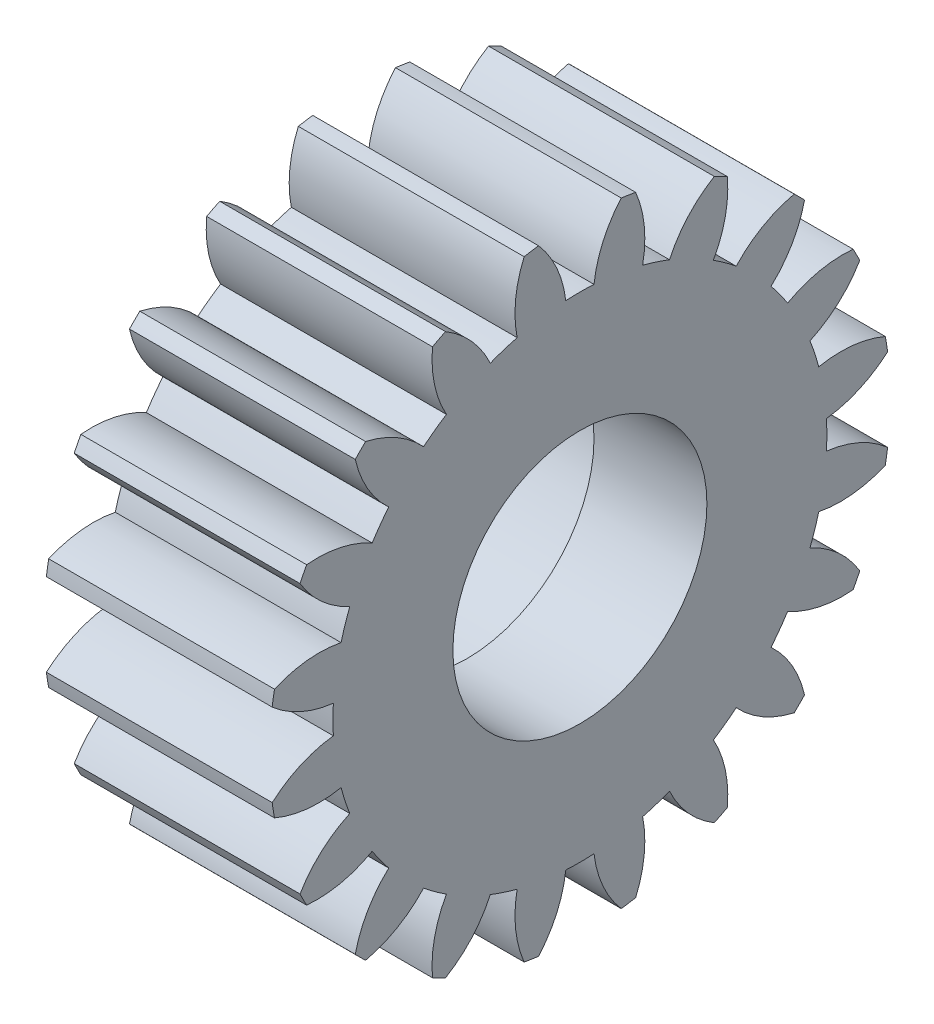
from build123d import *

# Parameters (mm, degrees)
BASPROSKE_W        = 10
BASPROSKE_H        = 11
TOOTHCUT_DEPTH     = 19.493242009
TEETHCUTS_COUNT    = 20
TEETHCUTS_ANGLE    = 342
BORSKE_R           = 2.5
BORE_DEPTH         = 50.0000508
SKETCH1_R          = 6.1
CUT_EXTRUDE1_DEPTH = 4
SKETCH2_R          = 4.5
CUT_EXTRUDE2_DEPTH = 19.376827944
SKETCH3_R          = 14.898414192
CUT_EXTRUDE3_DEPTH = 2


with BuildPart() as part:
    # BasProSke → Base-Revolve (revolve)
    with BuildSketch(Plane(origin=(0, 0, 0), x_dir=(1, 0, 0), z_dir=(0, 1, 0)), mode=Mode.PRIVATE) as base_revolve_sk:
        with Locations((5, 5.5)):
            Rectangle(BASPROSKE_W, BASPROSKE_H)
    revolve(base_revolve_sk.sketch.rotate(Axis((-10, 0, 0), (1, 0, 0)), 180), axis=Axis((-10, 0, 0), (1, 0, 0)))

    # TooCutSke → ToothCut (cut, through all)
    with BuildSketch(Plane(origin=(0, 0, 0), x_dir=(0, 0, -1), z_dir=(1, 0, 0))):
        with BuildLine():
            ThreePointArc((0.499924007, 8.734705318), (0, 8.749), (-0.499924007, 8.734705318))
            ThreePointArc((-0.499924007, 8.734705318), (-0.824302243, 9.905497836), (-1.485192705, 10.924909509))
            ThreePointArc((-1.485192705, 10.924909509), (0, 11.0254), (1.485192705, 10.924909509))
            ThreePointArc((1.485192705, 10.924909509), (0.824302243, 9.905497836), (0.499924007, 8.734705318))
        make_face()
    toothcut = extrude(amount=TOOTHCUT_DEPTH, mode=Mode.SUBTRACT)

    # TeethCuts: ToothCut ×20 about axis
    teethcuts_axis = Axis((-10, 0, 0), (1, 0, 0))
    for i in range(1, TEETHCUTS_COUNT):
        add(toothcut.rotate(teethcuts_axis, i * TEETHCUTS_ANGLE / (TEETHCUTS_COUNT - 1)), mode=Mode.SUBTRACT)

    # BorSke → Bore (cut, symmetric)
    with BuildSketch(Plane(origin=(0, 0, 0), x_dir=(0, 0, -1), z_dir=(1, 0, 0))):
        with Locations(Location((0, 0, 0), (0, 0, 180))):
            Circle(BORSKE_R)
    extrude(amount=BORE_DEPTH, both=True, mode=Mode.SUBTRACT)

    # Sketch1 → Cut-Extrude1 (cut)
    with BuildSketch(Plane.ZY):
        Circle(SKETCH1_R)
    extrude(amount=-CUT_EXTRUDE1_DEPTH, mode=Mode.SUBTRACT)

    # Sketch2 → Cut-Extrude2 (cut, through all)
    with BuildSketch(Plane(origin=(10, 0, 0), x_dir=(0, 0, -1), z_dir=(1, 0, 0))):
        Circle(SKETCH2_R)
    extrude(amount=-CUT_EXTRUDE2_DEPTH, mode=Mode.SUBTRACT)

    # Sketch3 → Cut-Extrude3 (cut)
    with BuildSketch(Plane(origin=(10, 0, 0), x_dir=(0, 0, -1), z_dir=(1, 0, 0))):
        Circle(SKETCH3_R)
    extrude(amount=-CUT_EXTRUDE3_DEPTH, mode=Mode.SUBTRACT)


solid = part.part
